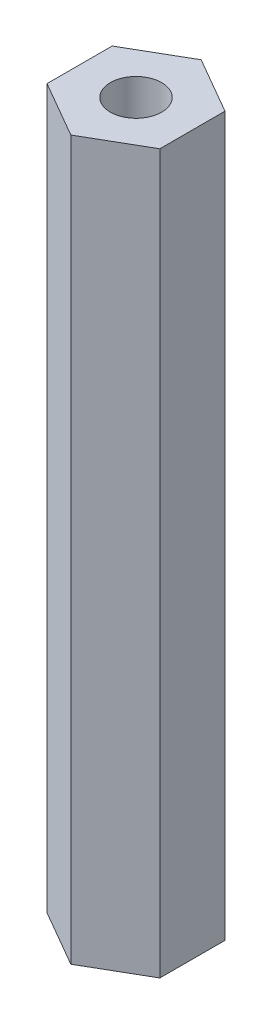
from build123d import *

# Parameters (mm, degrees)
BOSS_EXTRUDE1_DEPTH       = 35
M3X0_5_TAPPED_HOLE1_D     = 2.5
M3X0_5_TAPPED_HOLE1_DEPTH = 10
M3X0_5_TAPPED_HOLE1_TIP   = 0.751075774
M3X0_5_TAPPED_HOLE2_D     = 2.5
M3X0_5_TAPPED_HOLE2_DEPTH = 10
M3X0_5_TAPPED_HOLE2_TIP   = 0.751075774


with BuildPart() as part:
    # Sketch1 → Boss-Extrude1 (new body)
    with BuildSketch(Plane(origin=(0, 0, 0), x_dir=(1, 0, 0), z_dir=(0, 1, 0))):
        Polygon((0, 3.175426481), (-2.75, 1.58771324), (-2.75, -1.58771324), (0, -3.175426481), (2.75, -1.58771324), (2.75, 1.58771324), align=None)
    extrude(amount=BOSS_EXTRUDE1_DEPTH)

    # M3x0.5 Tapped Hole1
    with Locations(Plane(origin=(0, 35, 0), x_dir=(1, 0, 0), z_dir=(0, 1, 0))):
        with Locations((0, 0)):
            Hole(M3X0_5_TAPPED_HOLE1_D / 2, depth=M3X0_5_TAPPED_HOLE1_DEPTH)
            with Locations((0, 0, -(M3X0_5_TAPPED_HOLE1_DEPTH + M3X0_5_TAPPED_HOLE1_TIP / 2))):  # 118° drill point
                Cone(0, M3X0_5_TAPPED_HOLE1_D / 2, M3X0_5_TAPPED_HOLE1_TIP, mode=Mode.SUBTRACT)

    # M3x0.5 Tapped Hole2
    with Locations(Plane(origin=(0, 0, 0), x_dir=(-1, 0, 0), z_dir=(0, -1, 0))):
        with Locations((0, 0)):
            Hole(M3X0_5_TAPPED_HOLE2_D / 2, depth=M3X0_5_TAPPED_HOLE2_DEPTH)
            with Locations((0, 0, -(M3X0_5_TAPPED_HOLE2_DEPTH + M3X0_5_TAPPED_HOLE2_TIP / 2))):  # 118° drill point
                Cone(0, M3X0_5_TAPPED_HOLE2_D / 2, M3X0_5_TAPPED_HOLE2_TIP, mode=Mode.SUBTRACT)


solid = part.part
